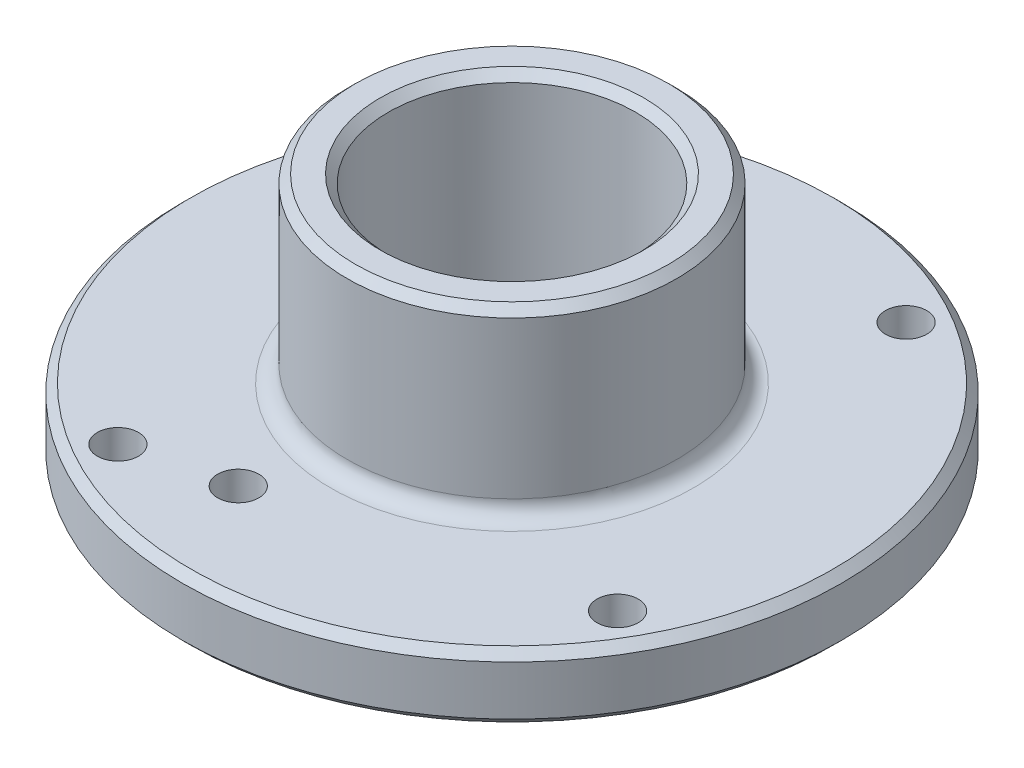
from build123d import *

# Parameters (mm, degrees)
FILLET1_R               = 2
CHAMFER1_SIZE           = 1
CHAMFER2_SIZE           = 0.5
CUT_EXTRUDE1_DEPTH      = 65.031242374
CUT_EXTRUDE1_DEPTH_BACK = 65.031242374
SKETCH2_R               = 2.5
CUT_EXTRUDE3_REACH      = 62.696
SKETCH5_R               = 2.5


with BuildPart() as part:
    # Sketch1 → Revolve1 (revolve)
    with BuildSketch(Plane.XY, mode=Mode.PRIVATE) as revolve1_sk:
        Polygon((-15, 0), (-15, 30), (-20, 30), (-20, 8), (-40, 8), (-40, 0), align=None)
    revolve(revolve1_sk.sketch.rotate(Axis((0, 0, 0), (0, 1, 0)), 270), axis=Axis((0, 0, 0), (0, 1, 0)))

    # Fillet1
    fillet1_edges = [part.edges().sort_by_distance(p)[0] for p in [
        (0, 8, 20),
    ]]
    fillet(fillet1_edges, radius=FILLET1_R)

    # Chamfer1
    chamfer1_edges = [part.edges().sort_by_distance(p)[0] for p in [
        (0, 0, 40),
        (0, 8, 40),
        (0, 30, 20),
        (0, 30, 15),
    ]]
    chamfer(chamfer1_edges, length=CHAMFER1_SIZE)

    # Chamfer2
    chamfer2_edges = [part.edges().sort_by_distance(p)[0] for p in [
        (0, 0, 15),
    ]]
    chamfer(chamfer2_edges, length=CHAMFER2_SIZE)

    # Sketch2 → Cut-Extrude1 (cut, two sides: drawn at the far end of the back side and taken through both)
    with BuildSketch(Plane.XZ.offset(-CUT_EXTRUDE1_DEPTH_BACK)):
        with Locations(Location((-5.821527343, 27.388132821, 0), (0, 0, 270))):
            Circle(SKETCH2_R)
    extrude(amount=CUT_EXTRUDE1_DEPTH + CUT_EXTRUDE1_DEPTH_BACK, mode=Mode.SUBTRACT)

    # Sketch5 → Cut-Extrude3 (cut, up to next)
    with BuildSketch(Plane(origin=(0, 8, 0), x_dir=(1, 0, 0), z_dir=(0, 1, 0)), mode=Mode.PRIVATE) as cut_extrude3_sk1:
        with Locations(Location((-17.5, -30.310889132, 0), (0, 0, 270))):
            Circle(SKETCH5_R)
    cut_extrude3_tool1 = extrude(cut_extrude3_sk1.sketch, amount=-CUT_EXTRUDE3_REACH, mode=Mode.PRIVATE) & part.part
    # Sketch5 → Cut-Extrude3 (cut, up to next)
    with BuildSketch(Plane(origin=(0, 8, 0), x_dir=(1, 0, 0), z_dir=(0, 1, 0)), mode=Mode.PRIVATE) as cut_extrude3_sk2:
        with Locations(Location((-30.310889132, 17.5, 0), (0, 0, 270))):
            Circle(SKETCH5_R)
    cut_extrude3_tool2 = extrude(cut_extrude3_sk2.sketch, amount=-CUT_EXTRUDE3_REACH, mode=Mode.PRIVATE) & part.part
    # Sketch5 → Cut-Extrude3 (cut, up to next)
    with BuildSketch(Plane(origin=(0, 8, 0), x_dir=(1, 0, 0), z_dir=(0, 1, 0)), mode=Mode.PRIVATE) as cut_extrude3_sk3:
        with Locations(Location((17.5, 30.310889132, 0), (0, 0, 270))):
            Circle(SKETCH5_R)
    cut_extrude3_tool3 = extrude(cut_extrude3_sk3.sketch, amount=-CUT_EXTRUDE3_REACH, mode=Mode.PRIVATE) & part.part
    # Sketch5 → Cut-Extrude3 (cut, up to next)
    with BuildSketch(Plane(origin=(0, 8, 0), x_dir=(1, 0, 0), z_dir=(0, 1, 0)), mode=Mode.PRIVATE) as cut_extrude3_sk4:
        with Locations(Location((30.310889132, -17.5, 0), (0, 0, 270))):
            Circle(SKETCH5_R)
    cut_extrude3_tool4 = extrude(cut_extrude3_sk4.sketch, amount=-CUT_EXTRUDE3_REACH, mode=Mode.PRIVATE) & part.part
    add(cut_extrude3_tool1.solids().sort_by_distance((-17.5, 8, 30.310889))[0], mode=Mode.SUBTRACT)
    add(cut_extrude3_tool2.solids().sort_by_distance((-30.310889, 8, -17.5))[0], mode=Mode.SUBTRACT)
    add(cut_extrude3_tool3.solids().sort_by_distance((17.5, 8, -30.310889))[0], mode=Mode.SUBTRACT)
    add(cut_extrude3_tool4.solids().sort_by_distance((30.310889, 8, 17.5))[0], mode=Mode.SUBTRACT)


solid = part.part
